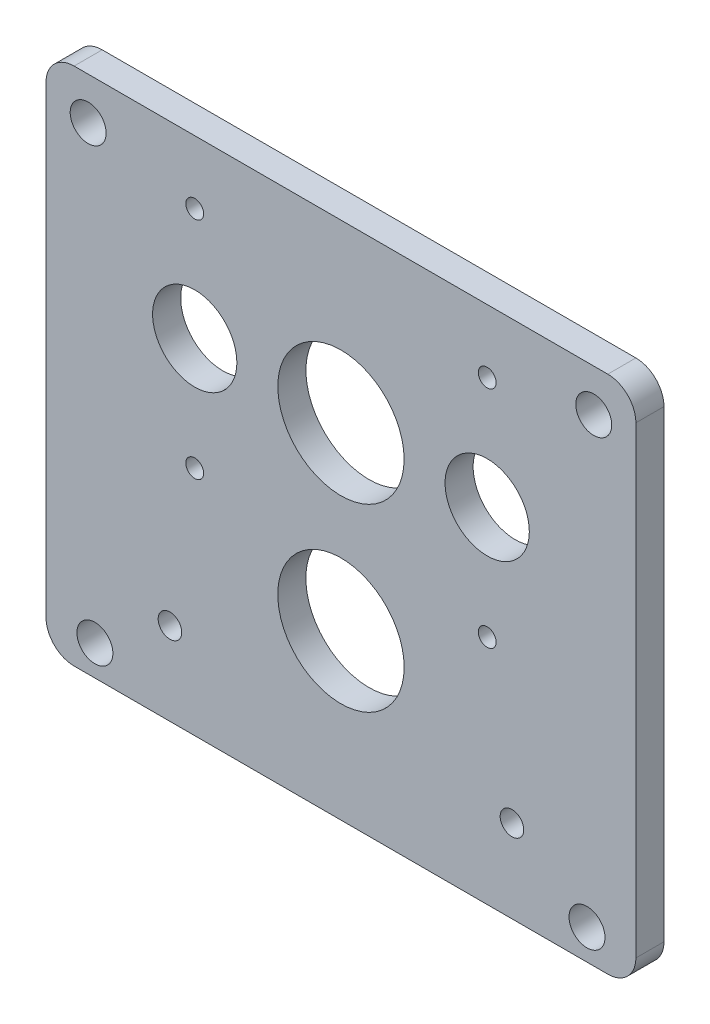
from build123d import *

# Parameters (mm, degrees)
SKETCH1_W           = 133.35
SKETCH1_H           = 117.475
SKETCH1_R           = 14.2748
SKETCH1_R_2         = 9.525
SKETCH1_R_3         = 2.0193
SKETCH1_R_4         = 14.2875
SKETCH1_R_5         = 4.064
SKETCH1_R_6         = 2.667
BOSS_EXTRUDE1_DEPTH = 3.175
FILLET1_R           = 6.35


with BuildPart() as part:
    # Sketch1 → Boss-Extrude1 (new, symmetric)
    with BuildSketch(Plane.XY):
        with Locations((0, 21.6789)):
            Rectangle(SKETCH1_W, SKETCH1_H)
        with Locations((0, 40.7162)):
            Circle(SKETCH1_R, mode=Mode.SUBTRACT)
        with Locations((33.0581, 40.7162)):
            Circle(SKETCH1_R_2, mode=Mode.SUBTRACT)
        with Locations((-33.0581, 40.7162)):
            Circle(SKETCH1_R_2, mode=Mode.SUBTRACT)
        with Locations((-33.0581, 66.1162)):
            Circle(SKETCH1_R_3, mode=Mode.SUBTRACT)
        with Locations((-33.0581, 15.3162)):
            Circle(SKETCH1_R_3, mode=Mode.SUBTRACT)
        Circle(SKETCH1_R_4, mode=Mode.SUBTRACT)
        with Locations((-57.15, 70.8914)):
            Circle(SKETCH1_R_5, mode=Mode.SUBTRACT)
        with Locations((-55.626, -30.2006)):
            Circle(SKETCH1_R_5, mode=Mode.SUBTRACT)
        with Locations((57.15, 70.8914)):
            Circle(SKETCH1_R_5, mode=Mode.SUBTRACT)
        with Locations((55.626, -30.2006)):
            Circle(SKETCH1_R_5, mode=Mode.SUBTRACT)
        with Locations((38.6588, -18.3134)):
            Circle(SKETCH1_R_6, mode=Mode.SUBTRACT)
        with Locations((-38.6588, -18.3134)):
            Circle(SKETCH1_R_6, mode=Mode.SUBTRACT)
        with Locations((33.0581, 66.1162)):
            Circle(SKETCH1_R_3, mode=Mode.SUBTRACT)
        with Locations((33.0581, 15.3162)):
            Circle(SKETCH1_R_3, mode=Mode.SUBTRACT)
    extrude(amount=BOSS_EXTRUDE1_DEPTH, both=True)

    # Fillet1
    fillet1_edges = [part.edges().sort_by_distance(p)[0] for p in [
        (66.675, -37.0586, 0),
        (-66.675, -37.0586, 0),
        (-66.675, 80.4164, 0),
        (66.675, 80.4164, 0),
    ]]
    fillet(fillet1_edges, radius=FILLET1_R)


solid = part.part
